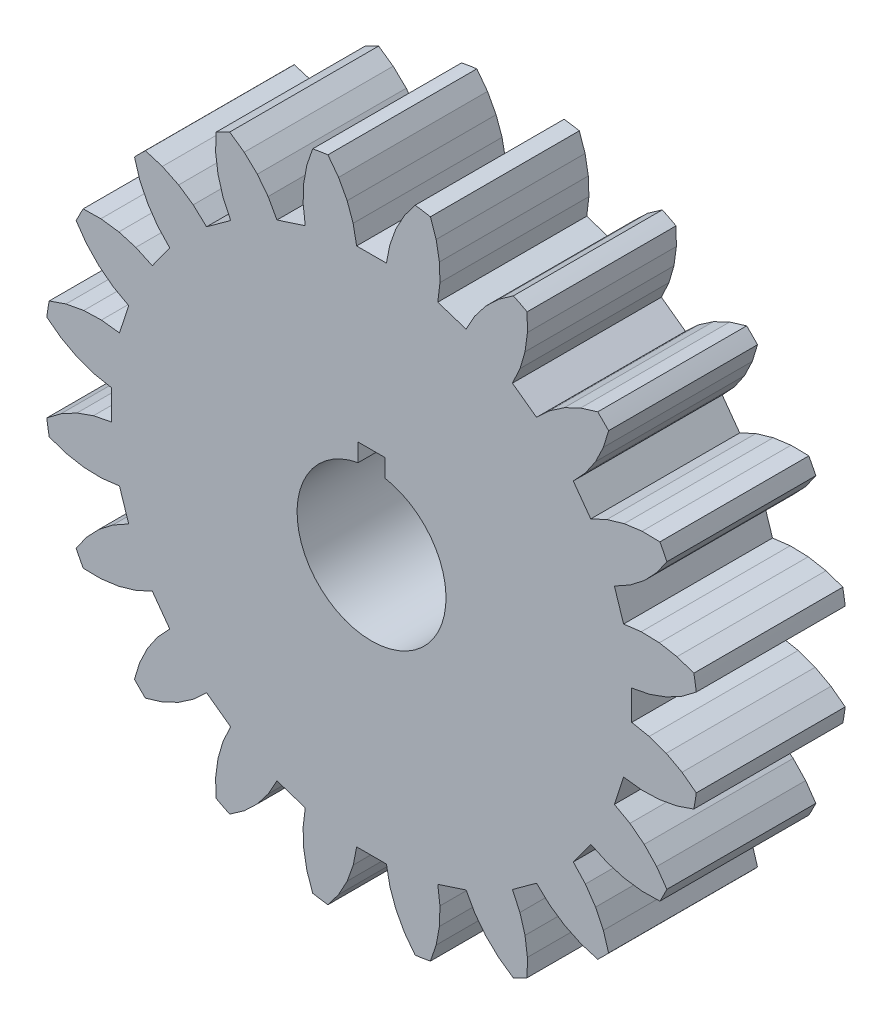
from build123d import *

# Parameters (mm, degrees)
CROQUIS1_R              = 11
SALIENTE_EXTRUIR1_DEPTH = 5
CORTAR_EXTRUIR6_DEPTH   = 5


with BuildPart() as part:
    # Croquis1 → Saliente-Extruir1 (new body)
    with BuildSketch(Plane.XY):
        with Locations((-0.441783127, 0.370500553)):
            Circle(CROQUIS1_R)
        with BuildLine():
            Line((-0.891783127, 2.829667079), (-0.891783127, 3.429667079))
            Line((-0.891783127, 3.429667079), (0.008216873, 3.429667079))
            Line((0.008216873, 3.429667079), (0.008216873, 2.829667079))
            ThreePointArc((0.008216873, 2.829667079), (-0.441783127, -2.129499447), (-0.891783127, 2.829667079))
        make_face(mode=Mode.SUBTRACT)
    extrude(amount=SALIENTE_EXTRUIR1_DEPTH)

    # Croquis6 → Cortar-Extruir6 (cut)
    with BuildSketch(Plane.XY.offset(5)):
        Polygon((6.330893957, 5.90907854), (6.918589875, 5.100184504), (7.460121205, 5.352322775), (8.041494908, 5.522784033), (8.640330703, 5.603393111), (9.239211014, 5.593368772), (8.939770859, 6.614636798), (8.340912806, 7.438894195), (7.517051439, 7.963718076), (7.34289312, 7.394569364), (7.079806731, 6.846434253), (6.746578092, 6.356898501), align=None)
        Polygon((8.244653353, 3.842577552), (7.710930269, 3.545128922), (8.019900298, 2.594216952), (8.612842208, 2.666672314), (9.218436883, 2.64913625), (9.812873143, 2.540749601), (10.379344475, 2.346151695), (10.410149139, 3.409967402), (10.095310829, 4.378940086), (9.473951606, 5.132664422), (9.132440577, 4.645189711), (8.712847488, 4.205180406), align=None)
        Polygon((8.892439689, 0.988385516), (8.292922191, 0.870424561), (8.292922191, -0.129423454), (8.879233397, -0.243743438), (9.449769217, -0.447560272), (9.981618378, -0.734333007), (10.46023057, -1.094455882), (10.818264679, -0.092226186), (10.818264679, 0.926611988), (10.46023057, 1.835456988), (9.984796311, 1.477373699), (9.449769217, 1.188561378), align=None)
        Polygon((8.626527261, -1.926289406), (8.019900298, -1.853215846), (7.710930269, -2.804127816), (8.233218545, -3.094032708), (8.712847488, -3.4641793), (9.130048451, -3.901266808), (9.473951606, -4.391663316), (10.124168287, -3.549124857), (10.439006597, -2.580152173), (10.379344475, -1.605150588), (9.816525803, -1.798790768), (9.218436883, -1.908135144), align=None)
        Polygon((7.472945429, -4.616138525), (6.918589875, -4.359183398), (6.330893957, -5.168077434), (6.738034087, -5.605189323), (7.079806731, -6.105433147), (7.341520957, -6.650050256), (7.517051439, -7.22271697), (8.395802953, -6.622343283), (8.994661006, -5.798085886), (9.239211014, -4.852367666), (8.644100543, -4.862609886), (8.041494908, -4.781782927), align=None)
        Polygon((5.544614821, -6.817860666), (5.09679486, -6.402176531), (4.287900824, -6.989872449), (4.540039095, -7.531403779), (4.710500353, -8.112777482), (4.791109431, -8.711613277), (4.781085092, -9.310493588), (5.802353118, -9.011053432), (6.626610515, -8.412195379), (7.151434396, -7.588334013), (6.582285684, -7.414175694), (6.034150573, -7.151089305), align=None)
        Polygon((3.030293872, -8.315935927), (2.732845242, -7.782212843), (1.781933272, -8.091182871), (1.854388634, -8.684124782), (1.83685257, -9.289719457), (1.728465921, -9.884155716), (1.533868015, -10.450627048), (2.597683722, -10.481431713), (3.566656407, -10.166593402), (4.320380742, -9.545234179), (3.832906031, -9.203723151), (3.392896726, -8.784130062), align=None)
        Polygon((0.176101836, -8.963722263), (0.058140881, -8.364204765), (-0.941707134, -8.364204765), (-1.056027117, -8.950515971), (-1.259843952, -9.521051791), (-1.546616687, -10.052900952), (-1.906739562, -10.531513144), (-0.904509866, -10.889547253), (0.114328308, -10.889547253), (1.023173308, -10.531513144), (0.665090019, -10.056078884), (0.376277698, -9.521051791), align=None)
        Polygon((-2.738573086, -8.697809835), (-2.665499526, -8.091182871), (-3.616411496, -7.782212843), (-3.906316387, -8.304501119), (-4.27646298, -8.784130062), (-4.713550488, -9.201331025), (-5.203946996, -9.545234179), (-4.361408537, -10.195450861), (-3.392435853, -10.510289171), (-2.417434268, -10.450627048), (-2.611074448, -9.887808376), (-2.720418824, -9.289719457), align=None)
        Polygon((-5.428422205, -7.544228003), (-5.171467078, -6.989872449), (-5.980361114, -6.402176531), (-6.417473003, -6.809316661), (-6.917716827, -7.151089305), (-7.462333936, -7.412803531), (-8.03500065, -7.588334013), (-7.434626963, -8.467085526), (-6.610369566, -9.065943579), (-5.664651346, -9.310493588), (-5.674893566, -8.715383117), (-5.594066607, -8.112777482), align=None)
        Polygon((-7.630144346, -5.615897395), (-7.214460211, -5.168077434), (-7.802156129, -4.359183398), (-8.343687459, -4.611321669), (-8.925061162, -4.781782927), (-9.523896957, -4.862392005), (-10.122777268, -4.852367666), (-9.823337112, -5.873635692), (-9.224479059, -6.697893089), (-8.400617693, -7.22271697), (-8.226459373, -6.653568258), (-7.963372985, -6.105433147), align=None)
        Polygon((-9.128219607, -3.101576446), (-8.594496523, -2.804127816), (-8.903466551, -1.853215846), (-9.496408462, -1.925671208), (-10.102003137, -1.908135144), (-10.696439396, -1.799748495), (-11.262910728, -1.605150588), (-11.293715393, -2.668966296), (-10.978877082, -3.63793898), (-10.357517859, -4.391663316), (-10.016006831, -3.904188605), (-9.596413742, -3.4641793), align=None)
        Polygon((-9.776005943, -0.247384409), (-9.176488445, -0.129423454), (-9.176488445, 0.870424561), (-9.762799651, 0.984744544), (-10.333335471, 1.188561378), (-10.865184632, 1.475334113), (-11.343796824, 1.835456988), (-11.701830933, 0.833227292), (-11.701830933, -0.185610882), (-11.343796824, -1.094455882), (-10.868362564, -0.736372593), (-10.333335471, -0.447560272), align=None)
        Polygon((-9.510093515, 2.667290513), (-8.903466551, 2.594216952), (-8.594496523, 3.545128922), (-9.116784799, 3.835033814), (-9.596413742, 4.205180406), (-10.013614705, 4.642267914), (-10.357517859, 5.132664422), (-11.00773454, 4.290125963), (-11.322572851, 3.321153279), (-11.262910728, 2.346151695), (-10.700092056, 2.539791874), (-10.102003137, 2.64913625), align=None)
        Polygon((-8.356511683, 5.357139631), (-7.802156129, 5.100184504), (-7.214460211, 5.90907854), (-7.621600341, 6.346190429), (-7.963372985, 6.846434253), (-8.225087211, 7.391051362), (-8.400617693, 7.963718076), (-9.279369206, 7.363344389), (-9.878227259, 6.539086992), (-10.122777268, 5.593368772), (-9.527666797, 5.603610992), (-8.925061162, 5.522784033), align=None)
        Polygon((-6.428181075, 7.558861772), (-5.980361114, 7.143177637), (-5.171467078, 7.730873555), (-5.423605349, 8.272404885), (-5.594066607, 8.853778588), (-5.674675685, 9.452614383), (-5.664651346, 10.051494694), (-6.685919372, 9.752054539), (-7.510176769, 9.153196486), (-8.03500065, 8.329335119), (-7.465851938, 8.1551768), (-6.917716827, 7.892090411), align=None)
        Polygon((-3.913860126, 9.056937033), (-3.616411496, 8.523213949), (-2.665499526, 8.832183978), (-2.737954888, 9.425125888), (-2.720418824, 10.030720563), (-2.612032175, 10.625156823), (-2.417434268, 11.191628155), (-3.481249976, 11.222432819), (-4.45022266, 10.907594509), (-5.203946996, 10.286235286), (-4.716472285, 9.944724257), (-4.27646298, 9.525131168), align=None)
        Polygon((-1.059668089, 9.704723369), (-0.941707134, 9.105205871), (0.058140881, 9.105205871), (0.172460864, 9.691517077), (0.376277698, 10.262052897), (0.663050433, 10.793902058), (1.023173308, 11.27251425), (0.020943612, 11.630548359), (-0.997894562, 11.630548359), (-1.906739562, 11.27251425), (-1.548656273, 10.797079991), (-1.259843952, 10.262052897), align=None)
        Polygon((1.855006833, 9.438810941), (1.781933272, 8.832183978), (2.732845242, 8.523213949), (3.022750134, 9.045502225), (3.392896726, 9.525131168), (3.829984234, 9.942332131), (4.320380742, 10.286235286), (3.477842283, 10.936451967), (2.508869599, 11.251290277), (1.533868015, 11.191628155), (1.727508194, 10.628809483), (1.83685257, 10.030720563), align=None)
        Polygon((4.544855951, 8.285229109), (4.287900824, 7.730873555), (5.09679486, 7.143177637), (5.533906749, 7.550317767), (6.034150573, 7.892090411), (6.578767682, 8.153804637), (7.151434396, 8.329335119), (6.551060709, 9.208086633), (5.726803312, 9.806944686), (4.781085092, 10.051494694), (4.791327312, 9.456384223), (4.710500353, 8.853778588), align=None)
    extrude(amount=-CORTAR_EXTRUIR6_DEPTH, mode=Mode.SUBTRACT)


solid = part.part
